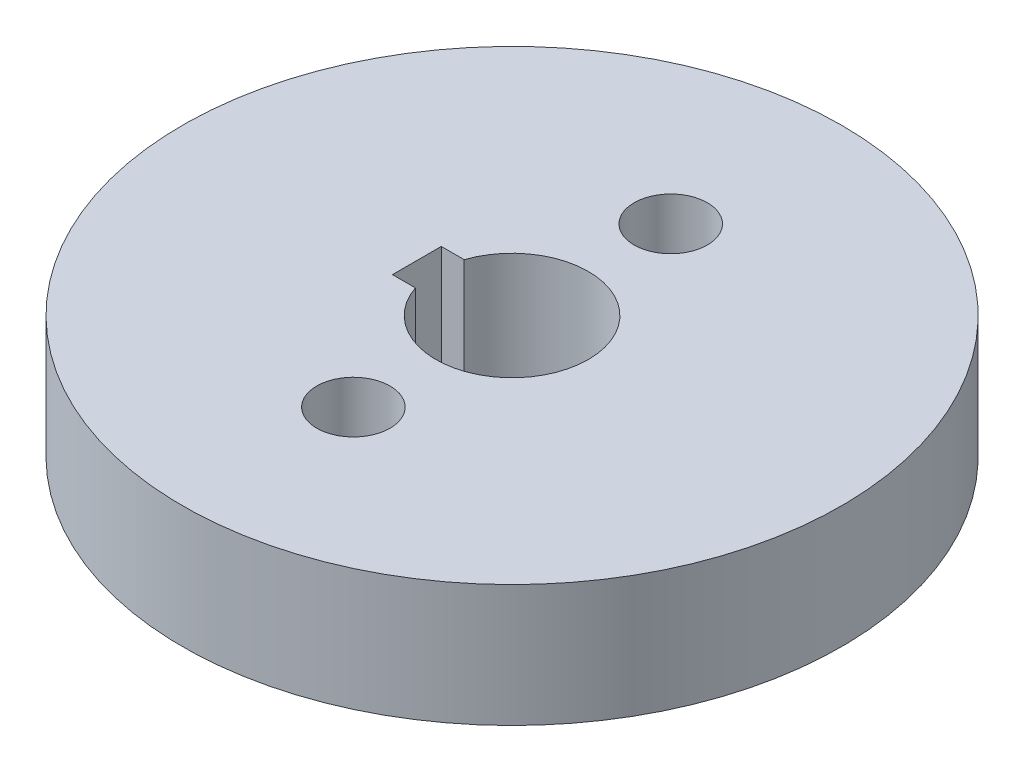
from build123d import *

# Parameters (mm, degrees)
SKETCH_1_W          = 41.5
SKETCH_1_H          = 20
SKETCH_2_R          = 6
CUT_EXTRUDE_1_DEPTH = 20
SKETCH_2_3_R        = 6
CUT_EXTRUDE_2_DEPTH = 20


with BuildPart() as part:
    # Эскиз1 → Повернуть1 (revolve)
    with BuildSketch(Plane.XY):
        with Locations((33.25, 10)):
            Rectangle(SKETCH_1_W, SKETCH_1_H)
    revolve(axis=Axis((0, 0, 0), (0, 1, 0)))

    # Эскиз2 → Вырез-Вытянуть1 (cut)
    with BuildSketch(Plane(origin=(0, 20, 0), x_dir=(1, 0, 0), z_dir=(0, 1, 0))):
        with Locations((0, 26)):
            Circle(SKETCH_2_R)
    extrude(amount=-CUT_EXTRUDE_1_DEPTH, mode=Mode.SUBTRACT)

    # Эскиз2<3> → Вырез-Вытянуть2 (cut)
    with BuildSketch(Plane(origin=(0, 20, 0), x_dir=(1, 0, 0), z_dir=(0, 1, 0))):
        with Locations((0, 26)):
            Circle(SKETCH_2_3_R)
        with Locations((0, -26)):
            Circle(SKETCH_2_3_R)
        with BuildLine():
            Line((-11.842719282, 4), (-15.6, 4))
            Line((-15.6, 4), (-15.6, -4))
            Line((-15.6, -4), (-11.842719282, -4))
            ThreePointArc((-11.842719282, -4), (12.5, 0), (-11.842719282, 4))
        make_face()
    extrude(amount=-CUT_EXTRUDE_2_DEPTH, mode=Mode.SUBTRACT)


solid = part.part
